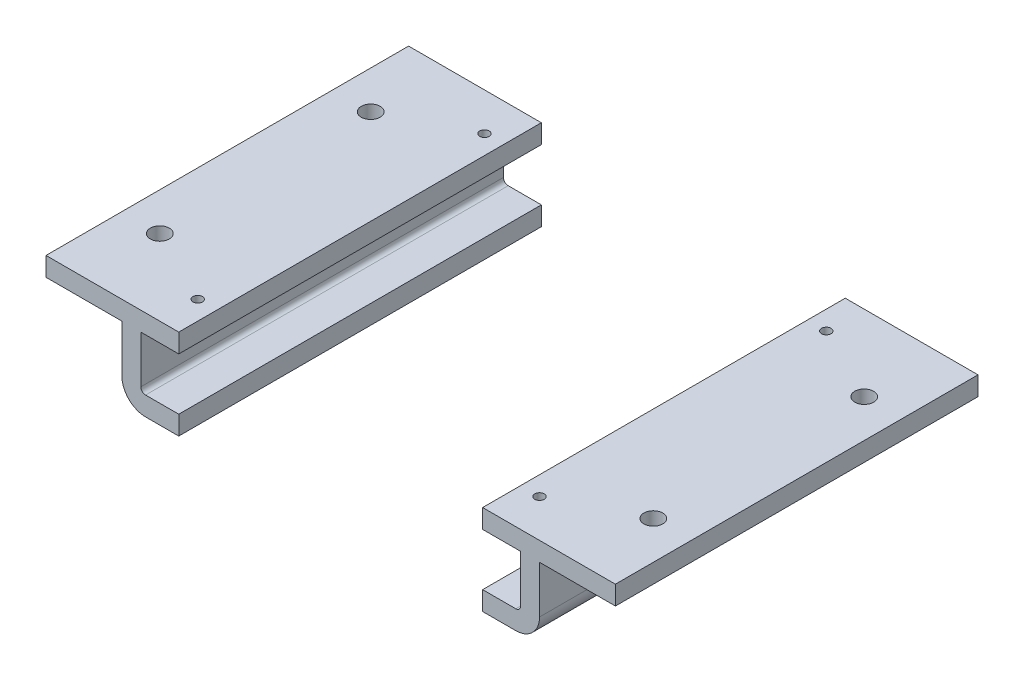
from build123d import *

# Parameters (mm, degrees)
BOSS_EXTRUDE2_DEPTH = 121.412
CUT_EXTRUDE1_REACH  = 159.282
SKETCH2_R           = 1.5875
SKETCH2_R_2         = 3.175


with BuildPart() as part:
    # Sketch1 → Boss-Extrude2 (new body)
    with BuildSketch(Plane.XY):
        with BuildLine():
            ThreePointArc((61.9887, 0), (63.111232015, 0.464967985), (63.5762, 1.5875))
            Line((63.5762, 1.5875), (63.5762, 17.4625))
            Line((63.5762, 17.4625), (50.8762, 17.4625))
            Line((50.8762, 17.4625), (50.8762, 23.8125))
            Line((50.8762, 23.8125), (95.3262, 23.8125))
            Line((95.3262, 23.8125), (95.3262, 17.4625))
            Line((95.3262, 17.4625), (69.9262, 17.4625))
            Line((69.9262, 17.4625), (69.9262, 1.5875))
            ThreePointArc((69.9262, 1.5875), (67.601360076, -4.025160076), (61.9887, -6.35))
            Line((61.9887, -6.35), (50.8762, -6.35))
            Line((50.8762, -6.35), (50.8762, 0))
            Line((50.8762, 0), (61.9887, 0))
        make_face()
    extrude(amount=-BOSS_EXTRUDE2_DEPTH)

    # Sketch2 → Cut-Extrude1 (cut, up to next)
    with BuildSketch(Plane(origin=(0, 23.8125, 0), x_dir=(1, 0, 0), z_dir=(0, 1, 0)), mode=Mode.PRIVATE) as cut_extrude1_sk1:
        with Locations(Location((57.2262, 108.712, 0), (0, 0, 270))):
            Circle(SKETCH2_R)
    cut_extrude1_tool1 = extrude(cut_extrude1_sk1.sketch, amount=-CUT_EXTRUDE1_REACH, mode=Mode.PRIVATE) & part.part
    # Sketch2 → Cut-Extrude1 (cut, up to next)
    with BuildSketch(Plane(origin=(0, 23.8125, 0), x_dir=(1, 0, 0), z_dir=(0, 1, 0)), mode=Mode.PRIVATE) as cut_extrude1_sk2:
        with Locations(Location((57.2262, 12.7, 0), (0, 0, 270))):
            Circle(SKETCH2_R)
    cut_extrude1_tool2 = extrude(cut_extrude1_sk2.sketch, amount=-CUT_EXTRUDE1_REACH, mode=Mode.PRIVATE) & part.part
    # Sketch2 → Cut-Extrude1 (cut, up to next)
    with BuildSketch(Plane(origin=(0, 23.8125, 0), x_dir=(1, 0, 0), z_dir=(0, 1, 0)), mode=Mode.PRIVATE) as cut_extrude1_sk3:
        with Locations(Location((82.6262, 96.012, 0), (0, 0, 270))):
            Circle(SKETCH2_R_2)
    cut_extrude1_tool3 = extrude(cut_extrude1_sk3.sketch, amount=-CUT_EXTRUDE1_REACH, mode=Mode.PRIVATE) & part.part
    # Sketch2 → Cut-Extrude1 (cut, up to next)
    with BuildSketch(Plane(origin=(0, 23.8125, 0), x_dir=(1, 0, 0), z_dir=(0, 1, 0)), mode=Mode.PRIVATE) as cut_extrude1_sk4:
        with Locations(Location((82.6262, 25.4, 0), (0, 0, 270))):
            Circle(SKETCH2_R_2)
    cut_extrude1_tool4 = extrude(cut_extrude1_sk4.sketch, amount=-CUT_EXTRUDE1_REACH, mode=Mode.PRIVATE) & part.part
    add(cut_extrude1_tool1.solids().sort_by_distance((57.2262, 23.8125, -108.712))[0], mode=Mode.SUBTRACT)
    add(cut_extrude1_tool2.solids().sort_by_distance((57.2262, 23.8125, -12.7))[0], mode=Mode.SUBTRACT)
    add(cut_extrude1_tool3.solids().sort_by_distance((82.6262, 23.8125, -96.012))[0], mode=Mode.SUBTRACT)
    add(cut_extrude1_tool4.solids().sort_by_distance((82.6262, 23.8125, -25.4))[0], mode=Mode.SUBTRACT)


with BuildPart() as body_2:
    # Mirror5: mirrored copy
    add(part.part.mirror(Plane.ZY))


solid = Compound([part.part, body_2.part])
